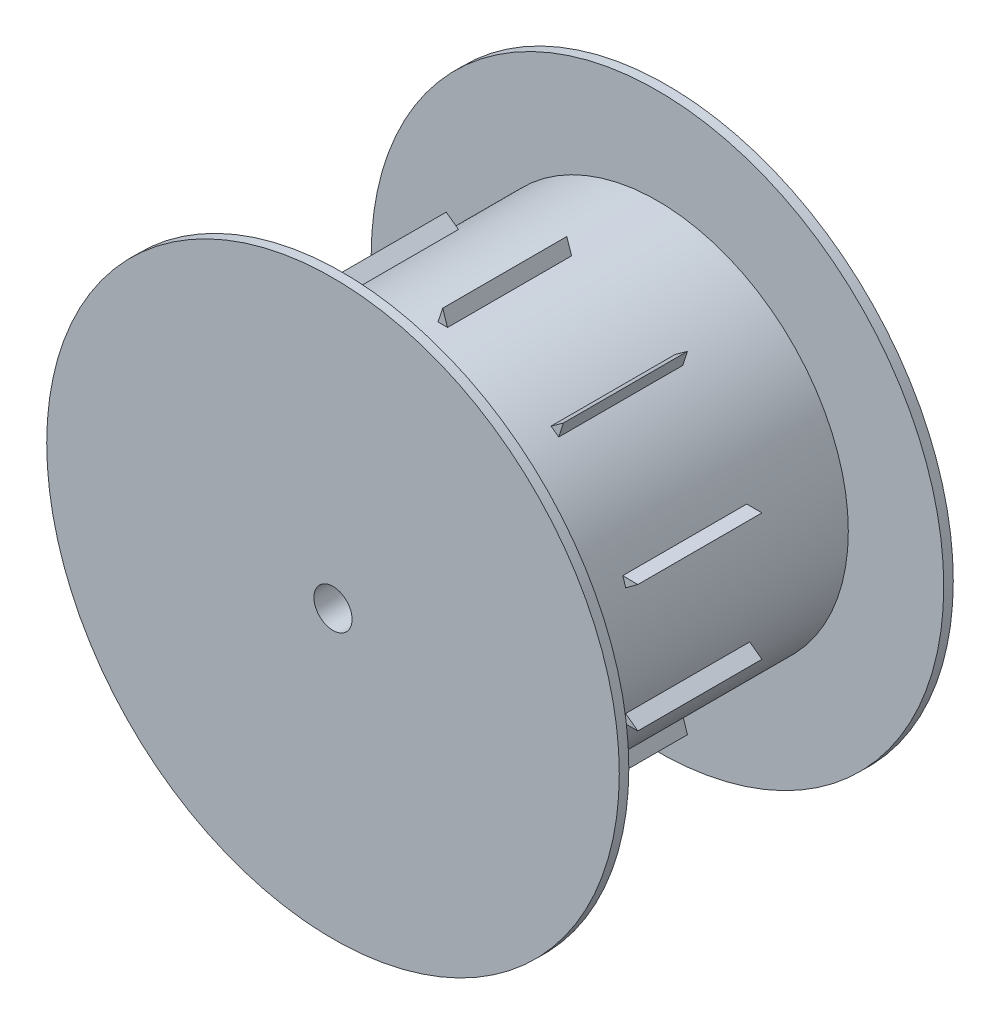
from build123d import *

# Parameters (mm, degrees)
SKETCH_1_R               = 20
EXTRUDE_1_DEPTH          = 35
SKETCH_3_R               = 30
EXTRUDE_2_DEPTH          = 1
EXTRUDE_START            = -1
SKETCH_4_R               = 30
EXTRUDE_3_DEPTH          = 1
CUT_EXTRUDE_2_DEPTH      = 56
CUT_EXTRUDE_2_DEPTH_BACK = 56
SKETCH_5_W               = 1
SKETCH_5_H               = 13
EXTRUDE_4_DEPTH          = 21.5
CUT_EXTRUDE_3_REACH      = 50.5
PATTERN_CIRCULAR_2_COUNT = 10
CUT_EXTRUDE_5_DEPTH      = 56
CUT_EXTRUDE_5_DEPTH_BACK = 56
SKETCH_9_R               = 5
EXTRUDE_5_DEPTH          = 35
SKETCH_10_R              = 2
CUT_EXTRUDE_6_DEPTH      = 56


with BuildPart() as part:
    # Эскиз1 → Бобышка-Вытянуть1 (new body)
    with BuildSketch(Plane.XY):
        Circle(SKETCH_1_R)
    extrude(amount=EXTRUDE_1_DEPTH)

    # Эскиз3 → Бобышка-Вытянуть2 (add)
    with BuildSketch(Plane.XY.offset(35)):
        Circle(SKETCH_3_R)
    extrude(amount=-EXTRUDE_2_DEPTH)

    # Эскиз4 → Бобышка-Вытянуть3 (add)
    with BuildSketch(Plane(origin=(0, 0, 0), x_dir=(-1, 0, 0), z_dir=(0, 0, -1)).offset(EXTRUDE_START)):
        with Locations(Location((0, 0, 0), (0, 0, 180))):
            Circle(SKETCH_4_R)
    extrude(amount=EXTRUDE_3_DEPTH)

    # Эскиз2 → Вырез-Вытянуть2 (cut, two sides: drawn at the far end of the back side and taken through both)
    with BuildSketch(Plane.XY.offset(35).offset(-CUT_EXTRUDE_2_DEPTH_BACK)):
        with BuildLine():
            Line((-1.944865034, 1.8), (1.944865034, 1.8))
            ThreePointArc((1.944865034, 1.8), (2.65, 0), (1.944865034, -1.8))
            Line((1.944865034, -1.8), (-1.944865034, -1.8))
            ThreePointArc((-1.944865034, -1.8), (-2.65, 0), (-1.944865034, 1.8))
        make_face()
    extrude(amount=CUT_EXTRUDE_2_DEPTH + CUT_EXTRUDE_2_DEPTH_BACK, mode=Mode.SUBTRACT)

    # Эскиз5 → Бобышка-Вытянуть4 (add)
    with BuildSketch(Plane(origin=(0, 0, 0), x_dir=(1, 0, 0), z_dir=(0, 1, 0))):
        with Locations((0, -17)):
            Rectangle(SKETCH_5_W, SKETCH_5_H)
    extrude_4 = extrude(amount=EXTRUDE_4_DEPTH)

    # Эскиз6 → Вырез-Вытянуть3 (cut, up to next)
    with BuildSketch(Plane.XY.offset(23.5), mode=Mode.PRIVATE) as cut_extrude_3_sk1:
        Polygon((-0.5, 19.993749023), (0, 21.5), (-0.5, 21.5), align=None)
    cut_extrude_3_tool1 = extrude(cut_extrude_3_sk1.sketch, amount=-CUT_EXTRUDE_3_REACH, mode=Mode.PRIVATE) & part.part
    # Эскиз6 → Вырез-Вытянуть3 (cut, up to next)
    with BuildSketch(Plane.XY.offset(23.5), mode=Mode.PRIVATE) as cut_extrude_3_sk2:
        Polygon((0.5, 21.5), (0, 21.5), (0.5, 19.993749023), align=None)
    cut_extrude_3_tool2 = extrude(cut_extrude_3_sk2.sketch, amount=-CUT_EXTRUDE_3_REACH, mode=Mode.PRIVATE) & part.part
    cut_extrude_3_1 = cut_extrude_3_tool1.solids().sort_by_distance((-0.333333, 20.997916, 23.5))[0]
    add(cut_extrude_3_1, mode=Mode.SUBTRACT)
    cut_extrude_3_2 = cut_extrude_3_tool2.solids().sort_by_distance((0.333333, 20.997916, 23.5))[0]
    add(cut_extrude_3_2, mode=Mode.SUBTRACT)
    cut_extrude_3 = cut_extrude_3_1 + cut_extrude_3_2  # Вырез-Вытянуть3 as one shape, for the pattern or mirror that repeats it

    # Круговой массив2: Бобышка-Вытянуть4, Вырез-Вытянуть3 ×10 about axis
    pattern_circular_2_axis = Axis((0, 0, 0), (0, 0, 1))
    add([extrude_4.rotate(pattern_circular_2_axis, i * 360 / PATTERN_CIRCULAR_2_COUNT) for i in range(1, PATTERN_CIRCULAR_2_COUNT)])
    add([cut_extrude_3.rotate(pattern_circular_2_axis, i * 360 / PATTERN_CIRCULAR_2_COUNT) for i in range(1, PATTERN_CIRCULAR_2_COUNT)], mode=Mode.SUBTRACT)

    # Эскиз8 → Вырез-Вытянуть5 (cut, two sides: drawn at the far end of the back side and taken through both)
    with BuildSketch(Plane.XY.offset(35).offset(-CUT_EXTRUDE_5_DEPTH_BACK)):
        with BuildLine():
            ThreePointArc((-1.944865034, -1.8), (-2.65, 0), (-1.944865034, 1.8))
            Line((-1.944865034, 1.8), (1.944865034, 1.8))
            ThreePointArc((1.944865034, 1.8), (2.65, 0), (1.944865034, -1.8))
            Line((1.944865034, -1.8), (-1.944865034, -1.8))
        make_face()
    extrude(amount=CUT_EXTRUDE_5_DEPTH + CUT_EXTRUDE_5_DEPTH_BACK, mode=Mode.SUBTRACT)

    # Эскиз9 → Бобышка-Вытянуть5 (add, through all)
    with BuildSketch(Plane.XY.offset(35)):
        Circle(SKETCH_9_R)
    extrude(amount=-EXTRUDE_5_DEPTH)

    # Эскиз10 → Вырез-Вытянуть6 (cut, through all)
    with BuildSketch(Plane.XY.offset(35)):
        Circle(SKETCH_10_R)
    extrude(amount=-CUT_EXTRUDE_6_DEPTH, mode=Mode.SUBTRACT)


solid = part.part
